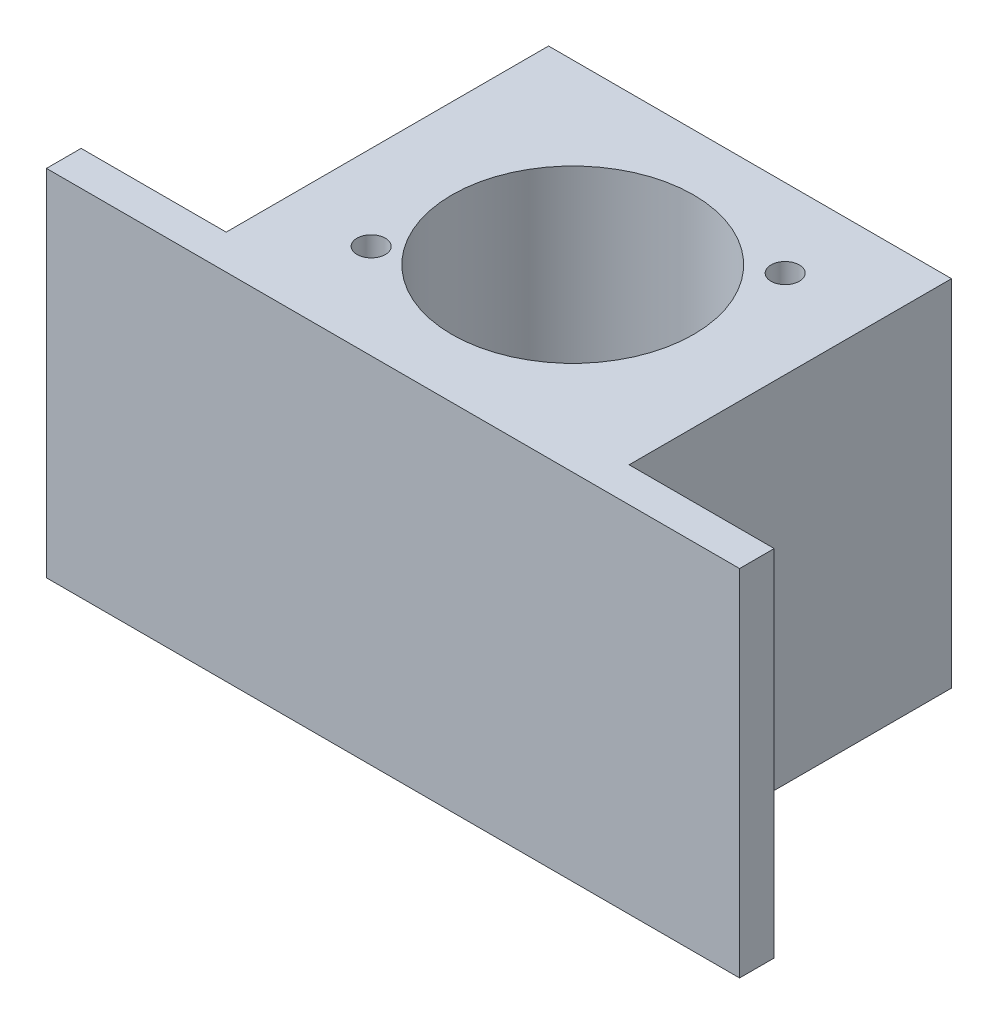
from build123d import *

# Parameters (mm, degrees)
SKETCH_2_W             = 215
SKETCH_2_H             = 110
EXTRUDE_1_DEPTH        = 30
SKETCH_3_W             = 125
SKETCH_3_H             = 110
EXTRUDE_2_DEPTH        = 100
SKETCH_4_R             = 37.5
CUT_EXTRUDE_1_DEPTH    = 202.385823731
M10X1_25_2_AT_2_COUNT  = 2
M10X1_25_2_AT_2_PITCH  = 91.374081536
PATTERN_LINEAR_1_COUNT = 2
PATTERN_LINEAR_1_PITCH = 110
CUT_EXTRUDE_9_DEPTH    = 10
M10X1_25_4_D           = 8.8
M10X1_25_4_DEPTH       = 33.356213276
M10X1_25_4_TIP         = 2.643786724
SKETCH_28_W            = 215
SKETCH_28_H            = 19.25
CUT_EXTRUDE_11_DEPTH   = 110


with BuildPart() as part:
    # 草图2 → 凸台-拉伸1 (new body)
    with BuildSketch(Plane.XY):
        Rectangle(SKETCH_2_W, SKETCH_2_H)
    extrude(amount=-EXTRUDE_1_DEPTH)

    # 草图3 → 凸台-拉伸2 (add)
    with BuildSketch(Plane(origin=(0, 0, -30), x_dir=(-1, 0, 0), z_dir=(0, 0, -1))):
        Rectangle(SKETCH_3_W, SKETCH_3_H)
    extrude(amount=EXTRUDE_2_DEPTH)

    # 草图4 → 切除-拉伸1 (cut, through all)
    with BuildSketch(Plane(origin=(0, 55, 0), x_dir=(1, 0, 0), z_dir=(0, 1, 0))):
        with Locations(Location((0, 75, 0), (0, 0, 270))):
            Circle(SKETCH_4_R)
    extrude(amount=-CUT_EXTRUDE_1_DEPTH, mode=Mode.SUBTRACT)

    # 草图9 → M10x1.25 螺纹孔2 (revolve, cut)
    with BuildSketch(Plane(origin=(-36.193891144, 55, -48.668021168), x_dir=(0, 0, 1), z_dir=(1, 0, 0))):
        Polygon((0, 0), (0, 36), (4.4, 33.356213276), (4.4, 0), align=None)
    m10x1_25_2 = revolve(axis=Axis((-36.193891144, 61.35, -48.668021168), (0, -1, 0)), mode=Mode.SUBTRACT)

    # M10x1.25 螺纹孔2 at 2: M10x1.25 螺纹孔2 ×2
    with Locations(*[Vector(0.7813475015769275, 0, -0.624096211957334) * (i * M10X1_25_2_AT_2_PITCH) for i in range(1, M10X1_25_2_AT_2_COUNT)]):
        add(m10x1_25_2, mode=Mode.SUBTRACT)

    # 阵列(线性)1: M10x1.25 螺纹孔2 ×2
    with Locations(*[(0, i * PATTERN_LINEAR_1_PITCH, 0) for i in range(1, PATTERN_LINEAR_1_COUNT)]):
        add(m10x1_25_2, mode=Mode.SUBTRACT)

    # 阵列(线性)1 copy 1 sketch → 阵列(线性)1 copy 1 (revolve, cut)
    with BuildSketch(Plane(origin=(35.201019173, 165, -105.694239325), x_dir=(0, 0, 1), z_dir=(1, 0, 0))):
        Polygon((0, 0), (0, 36), (4.4, 33.356213276), (4.4, 0), align=None)
    revolve(axis=Axis((35.201019173, 171.35, -105.694239325), (0, -1, 0)), mode=Mode.SUBTRACT)

    # 草图14 → 切除-拉伸9 (cut)
    with BuildSketch(Plane(origin=(0, 0, -30), x_dir=(-1, 0, 0), z_dir=(0, 0, -1))):
        with BuildLine():
            Line((82.5, 45), (82.5, 25))
            ThreePointArc((82.5, 25), (77.5, 20), (72.5, 25))
            Line((72.5, 25), (72.5, 45))
            ThreePointArc((72.5, 45), (77.5, 50), (82.5, 45))
        make_face()
        with BuildLine():
            Line((-67.5, 45), (-67.5, 25))
            ThreePointArc((-67.5, 25), (-72.5, 20), (-77.5, 25))
            Line((-77.5, 25), (-77.5, 45))
            ThreePointArc((-77.5, 45), (-72.5, 50), (-67.5, 45))
        make_face()
        with BuildLine():
            Line((82.5, -25), (82.5, -45))
            ThreePointArc((82.5, -45), (77.5, -50), (72.5, -45))
            Line((72.5, -45), (72.5, -25))
            ThreePointArc((72.5, -25), (77.5, -20), (82.5, -25))
        make_face()
        with BuildLine():
            Line((-67.5, -25), (-67.5, -45))
            ThreePointArc((-67.5, -45), (-72.5, -50), (-77.5, -45))
            Line((-77.5, -45), (-77.5, -25))
            ThreePointArc((-77.5, -25), (-72.5, -20), (-67.5, -25))
        make_face()
    extrude(amount=-CUT_EXTRUDE_9_DEPTH, mode=Mode.SUBTRACT)

    # M10x1.25 螺纹孔4
    with Locations(Plane(origin=(0, -55, 0), x_dir=(-1, 0, 0), z_dir=(0, -1, 0))):
        with Locations((-34.688229548, 40.374629495), (34.423841578, 110.405583489)):
            Hole(M10X1_25_4_D / 2, depth=M10X1_25_4_DEPTH)
            with Locations((0, 0, -(M10X1_25_4_DEPTH + M10X1_25_4_TIP / 2))):  # 118° drill point
                Cone(0, M10X1_25_4_D / 2, M10X1_25_4_TIP, mode=Mode.SUBTRACT)

    # 草图28 → 切除-拉伸11 (cut)
    with BuildSketch(Plane.XZ.offset(55)):
        with Locations((0, -9.625)):
            Rectangle(SKETCH_28_W, SKETCH_28_H)
    extrude(amount=-CUT_EXTRUDE_11_DEPTH, mode=Mode.SUBTRACT)


solid = part.part
